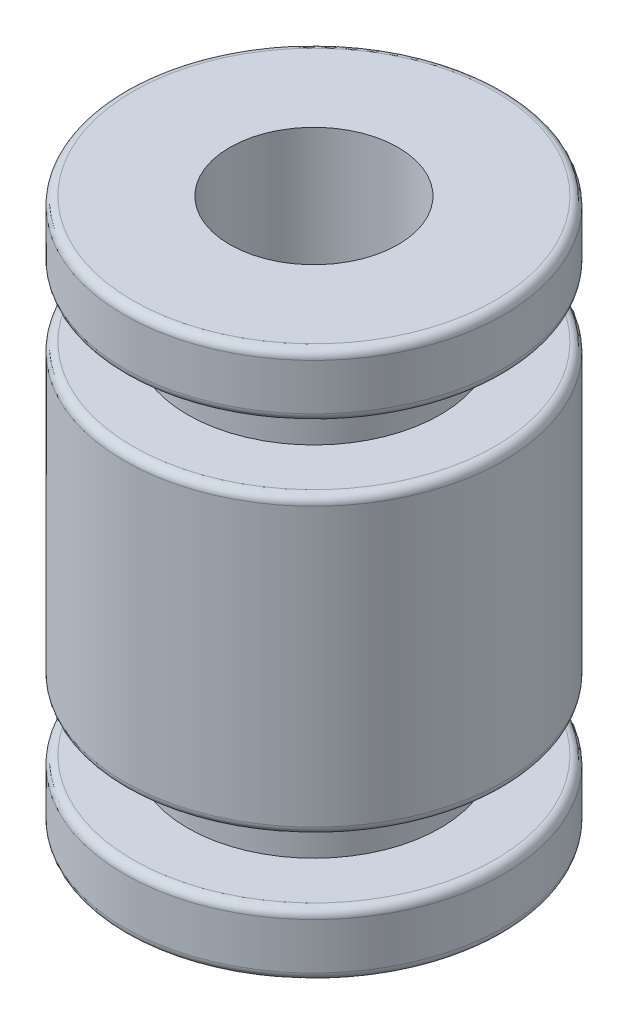
from build123d import *

# Parameters (mm, degrees)
SKETCH1_R           = 4.5
SKETCH1_R_2         = 2
BOSS_EXTRUDE1_DEPTH = 1.5
SKETCH2_R           = 3
SKETCH2_R_2         = 2
BOSS_EXTRUDE2_DEPTH = 1.5
SKETCH3_R           = 4.5
SKETCH3_R_2         = 2
BOSS_EXTRUDE3_DEPTH = 7
SKETCH4_R           = 3
SKETCH4_R_2         = 2
BOSS_EXTRUDE4_DEPTH = 1.5
SKETCH5_R           = 4.5
SKETCH5_R_2         = 2
BOSS_EXTRUDE5_DEPTH = 1.5
FILLET1_R           = 0.2


with BuildPart() as part:
    # Sketch1 → Boss-Extrude1 (new body)
    with BuildSketch(Plane(origin=(0, 0, 0), x_dir=(1, 0, 0), z_dir=(0, 1, 0))):
        with Locations(Location((0, 0, 0), (0, 0, 270))):
            Circle(SKETCH1_R)
        with Locations(Location((0, 0, 0), (0, 0, 270))):
            Circle(SKETCH1_R_2, mode=Mode.SUBTRACT)
    extrude(amount=BOSS_EXTRUDE1_DEPTH)

    # Sketch2 → Boss-Extrude2 (add)
    with BuildSketch(Plane(origin=(0, 1.5, 0), x_dir=(1, 0, 0), z_dir=(0, 1, 0))):
        with Locations(Location((0, 0, 0), (0, 0, 270))):
            Circle(SKETCH2_R)
        with Locations(Location((0, 0, 0), (0, 0, 270))):
            Circle(SKETCH2_R_2, mode=Mode.SUBTRACT)
    extrude(amount=BOSS_EXTRUDE2_DEPTH)

    # Sketch3 → Boss-Extrude3 (add)
    with BuildSketch(Plane(origin=(0, 3, 0), x_dir=(1, 0, 0), z_dir=(0, 1, 0))):
        with Locations(Location((0, 0, 0), (0, 0, 270))):
            Circle(SKETCH3_R)
        with Locations(Location((0, 0, 0), (0, 0, 270))):
            Circle(SKETCH3_R_2, mode=Mode.SUBTRACT)
    extrude(amount=BOSS_EXTRUDE3_DEPTH)

    # Sketch4 → Boss-Extrude4 (add)
    with BuildSketch(Plane(origin=(0, 10, 0), x_dir=(1, 0, 0), z_dir=(0, 1, 0))):
        with Locations(Location((0, 0, 0), (0, 0, 270))):
            Circle(SKETCH4_R)
        with Locations(Location((0, 0, 0), (0, 0, 270))):
            Circle(SKETCH4_R_2, mode=Mode.SUBTRACT)
    extrude(amount=BOSS_EXTRUDE4_DEPTH)

    # Sketch5 → Boss-Extrude5 (add)
    with BuildSketch(Plane(origin=(0, 11.5, 0), x_dir=(1, 0, 0), z_dir=(0, 1, 0))):
        with Locations(Location((0, 0, 0), (0, 0, 270))):
            Circle(SKETCH5_R)
        with Locations(Location((0, 0, 0), (0, 0, 270))):
            Circle(SKETCH5_R_2, mode=Mode.SUBTRACT)
    extrude(amount=BOSS_EXTRUDE5_DEPTH)

    # Fillet1
    fillet1_edges = [part.edges().sort_by_distance(p)[0] for p in [
        (0, 10, -4.5),
        (0, 3, -4.5),
        (0, 0, -4.5),
        (0, 13, -4.5),
        (0, 11.5, -4.5),
        (0, 1.5, -4.5),
    ]]
    fillet(fillet1_edges, radius=FILLET1_R)


solid = part.part
